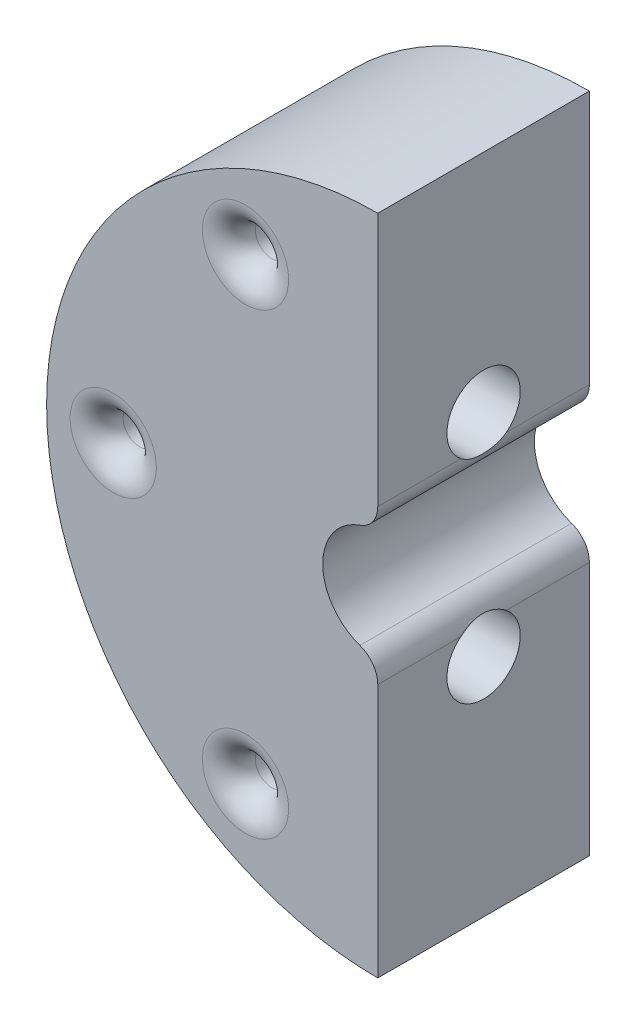
from build123d import *

# Parameters (mm, degrees)
SKETCH1_R                      = 9.9375
SKETCH1_R_2                    = 1.651
SKETCH1_R_3                    = 0.5
BOSS_EXTRUDE1_DEPTH            = 6.35
CUT_EXTRUDE1_DEPTH             = 16.421748036
FILLET1_R                      = 0.79375
FILLET2_R                      = 0.79375
CBORE_FOR_M2_SHCS1_D           = 2.2
CBORE_FOR_M2_SHCS1_CBORE_D     = 4.4
CBORE_FOR_M2_SHCS1_CBORE_DEPTH = 5.175


with BuildPart() as part:
    # Sketch1 → Boss-Extrude1 (new body)
    with BuildSketch(Plane.XY):
        Circle(SKETCH1_R)
        Circle(SKETCH1_R_2, mode=Mode.SUBTRACT)
        with Locations((-7.9375, 0)):
            Circle(SKETCH1_R_3, mode=Mode.SUBTRACT)
        with Locations((-3.96875, 6.874076643)):
            Circle(SKETCH1_R_3, mode=Mode.SUBTRACT)
        with Locations((3.96875, 6.874076643)):
            Circle(SKETCH1_R_3, mode=Mode.SUBTRACT)
        with Locations((7.9375, 0)):
            Circle(SKETCH1_R_3, mode=Mode.SUBTRACT)
        with Locations((3.96875, -6.874076643)):
            Circle(SKETCH1_R_3, mode=Mode.SUBTRACT)
        with Locations((-3.96875, -6.874076643)):
            Circle(SKETCH1_R_3, mode=Mode.SUBTRACT)
    extrude(amount=BOSS_EXTRUDE1_DEPTH)

    # Sketch2 → Cut-Extrude1 (cut, through all)
    with BuildSketch(Plane.XY.offset(6.35)):
        Polygon((0, 0), (0, 25.4), (50.8, 25.4), (50.8, -25.4), (0, -25.4), align=None)
    extrude(amount=-CUT_EXTRUDE1_DEPTH, mode=Mode.SUBTRACT)

    # Fillet1
    fillet1_edges = [part.edges().sort_by_distance(p)[0] for p in [
        (0, -1.651, 3.175),
        (0, 1.651, 3.175),
    ]]
    fillet(fillet1_edges, radius=FILLET1_R)

    # Fillet2
    fillet2_edges = [part.edges().sort_by_distance(p)[0] for p in [
        (-4.46875, 6.874076643, 0),
        (-4.46875, 6.874076643, 6.35),
        (-4.46875, -6.874076643, 0),
        (-4.46875, -6.874076643, 6.35),
        (-8.4375, 0, 0),
        (-8.4375, 0, 6.35),
    ]]
    fillet(fillet2_edges, radius=FILLET2_R)

    # CBORE for M2 SHCS1 (through all)
    with Locations(Plane.ZY.offset(9.9375)):
        with Locations((3.175, 3.175), (3.175, -3.175)):
            CounterBoreHole(CBORE_FOR_M2_SHCS1_D / 2, CBORE_FOR_M2_SHCS1_CBORE_D / 2, CBORE_FOR_M2_SHCS1_CBORE_DEPTH)


solid = part.part
